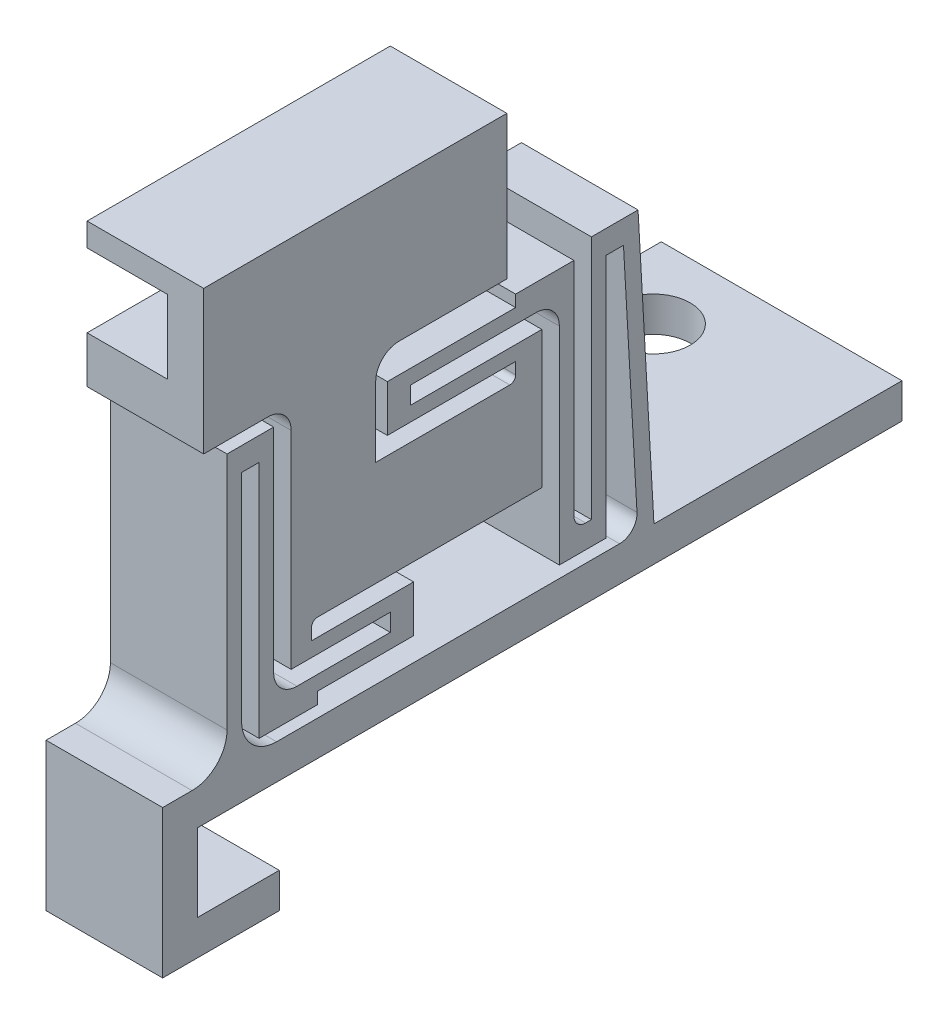
from build123d import *

# Parameters (mm, degrees)
FLEXURE_BOSS_DEPTH            = 5
SKETCH2_W                     = 10.32
SKETCH2_H                     = 18
SKETCH2_R                     = 1.575
MOUNTING_PLATE_BOSS_DEPTH     = 1.5
DOVETAIL_CONNECTION_CUT_DEPTH = 3.455


with BuildPart() as part:
    # Sketch1 → Flexure Boss (new body)
    with BuildSketch(Plane(origin=(0, 0, 0), x_dir=(0, 0, -1), z_dir=(1, 0, 0))):
        with BuildLine():
            Line((3.743651747, -1.066915143), (8.368651984, -1.066915143))
            Line((8.368651984, -1.066915143), (8.368651984, 5.083084857))
            Line((8.368651984, 5.083084857), (-4.631348016, 5.083084857))
            Line((-4.631348016, 5.083084857), (-4.631348016, -1.066915143))
            Line((-4.631348016, -1.066915143), (-1.881348253, -1.066915143))
            ThreePointArc((-1.881348253, -1.066915143), (-1.174241471, -1.359808362), (-0.881348253, -2.066915143))
            Line((-0.881348253, -2.066915143), (-0.881348253, -10.941915143))
            Line((-0.881348253, -10.941915143), (3.368651984, -10.941915143))
            Line((3.368651984, -10.941915143), (3.368651984, -11.691915143))
            Line((3.368651984, -11.691915143), (-0.631348016, -11.691915143))
            ThreePointArc((-0.631348016, -11.691915143), (-1.338454797, -11.399021924), (-1.631348016, -10.691915143))
            Line((-1.631348016, -10.691915143), (-1.631348016, -1.566915143))
            Line((-1.631348016, -1.566915143), (-3.631348016, -1.566915143))
            Line((-3.631348016, -1.566915143), (-3.631348016, -11.816915143))
            ThreePointArc((-3.631348016, -11.816915143), (-4.070687844, -12.877575315), (-5.131348016, -13.316915143))
            Line((-5.131348016, -13.316915143), (-6.391348016, -13.316915143))
            Line((-6.391348016, -13.316915143), (-6.391348016, -19.646915143))
            Line((-6.391348016, -19.646915143), (-1.391348016, -19.646915143))
            Line((-1.391348016, -19.646915143), (-1.391348016, -18.146915143))
            Line((-1.391348016, -18.146915143), (-4.891348016, -18.146915143))
            Line((-4.891348016, -18.146915143), (-4.891348016, -14.816915143))
            Line((-4.891348016, -14.816915143), (-4.631348016, -14.816915143))
            Line((-4.631348016, -14.816915143), (14.675469929, -14.816915143))
            Line((14.675469929, -14.816915143), (14.675469929, -13.316915143))
            Line((14.675469929, -13.316915143), (13.993651747, -1.316915143))
            Line((13.993651747, -1.316915143), (11.993651747, -1.316915143))
            Line((11.993651747, -1.316915143), (11.993651747, -11.816915143))
            Line((11.993651747, -11.816915143), (11.743651747, -11.816915143))
            ThreePointArc((11.743651747, -11.816915143), (11.390098357, -11.670468534), (11.243651747, -11.316915143))
            Line((11.243651747, -11.316915143), (11.243651747, -1.816915143))
            Line((11.243651747, -1.816915143), (8.743651747, -1.816915143))
            Line((8.743651747, -1.816915143), (8.743651747, -2.316915143))
            Line((8.743651747, -2.316915143), (3.243651747, -2.316915143))
            Line((3.243651747, -2.316915143), (3.243651747, -4.316915143))
            Line((3.243651747, -4.316915143), (8.743651747, -4.316915143))
            Line((8.743651747, -4.316915143), (8.743651747, -4.816915143))
            ThreePointArc((8.743651747, -4.816915143), (8.670428443, -4.993691838), (8.493651747, -5.066915143))
            Line((8.493651747, -5.066915143), (2.743651747, -5.066915143))
            Line((2.743651747, -5.066915143), (2.743651747, -2.066915143))
            ThreePointArc((2.743651747, -2.066915143), (3.036544966, -1.359808362), (3.743651747, -1.066915143))
        make_face()
        with BuildLine():
            Line((0.243651747, -9.566915143), (9.868651747, -9.566915143))
            Line((9.868651747, -9.566915143), (9.868651747, -3.691915143))
            Line((9.868651747, -3.691915143), (4.243651747, -3.691915143))
            Line((4.243651747, -3.691915143), (4.243651747, -2.941915143))
            Line((4.243651747, -2.941915143), (9.618651747, -2.941915143))
            ThreePointArc((9.618651747, -2.941915143), (10.325758529, -3.234808362), (10.618651747, -3.941915143))
            Line((10.618651747, -3.941915143), (10.618651747, -12.816915143))
            Line((10.618651747, -12.816915143), (12.618651747, -12.816915143))
            Line((12.618651747, -12.816915143), (12.618651747, -2.316915143))
            Line((12.618651747, -2.316915143), (13.368651747, -2.316915143))
            Line((13.368651747, -2.316915143), (13.948620781, -12.524370125))
            ThreePointArc((13.948620781, -12.524370125), (13.744993017, -13.0819837), (13.199828472, -13.316915143))
            Line((13.199828472, -13.316915143), (-1.506348016, -13.316915143))
            ThreePointArc((-1.506348016, -13.316915143), (-2.567008187, -12.877575315), (-3.006348016, -11.816915143))
            Line((-3.006348016, -11.816915143), (-3.006348016, -2.566915143))
            Line((-3.006348016, -2.566915143), (-2.256348016, -2.566915143))
            Line((-2.256348016, -2.566915143), (-2.256348016, -12.816915143))
            Line((-2.256348016, -12.816915143), (0.243651984, -12.816915143))
            Line((0.243651984, -12.816915143), (0.243651984, -12.316915143))
            Line((0.243651984, -12.316915143), (4.368651984, -12.316915143))
            Line((4.368651984, -12.316915143), (4.368651984, -10.316915143))
            Line((4.368651984, -10.316915143), (-0.006348253, -10.316915143))
            Line((-0.006348253, -10.316915143), (-0.006348253, -9.816915143))
            ThreePointArc((-0.006348253, -9.816915143), (0.066875052, -9.640138448), (0.243651747, -9.566915143))
        make_face(mode=Mode.SUBTRACT)
    extrude(amount=FLEXURE_BOSS_DEPTH)

    # Sketch2 → Mounting Plate Boss (add)
    with BuildSketch(Plane.XZ.offset(14.816915143)):
        with Locations((-0.16, -16.309568548)):
            Rectangle(SKETCH2_W, SKETCH2_H)
        with Locations(Location((-2.435, -10.088651984, 0), (0, 0, 270))):
            Circle(SKETCH2_R, mode=Mode.SUBTRACT)
        with Locations(Location((-2.435, -22.088651984, 0), (0, 0, 270))):
            Circle(SKETCH2_R, mode=Mode.SUBTRACT)
    extrude(amount=-MOUNTING_PLATE_BOSS_DEPTH)

    # Sketch7 → Dovetail Connection Cut (cut)
    with BuildSketch(Plane.ZY):
        Polygon((-8.368651984, 0.933084857), (4.631348016, 0.933084857), (4.631348016, 4.083084857), (-1.868651984, 3.083084857), (-8.368651984, 4.083084857), align=None)
    extrude(amount=-DOVETAIL_CONNECTION_CUT_DEPTH, mode=Mode.SUBTRACT)


solid = part.part
